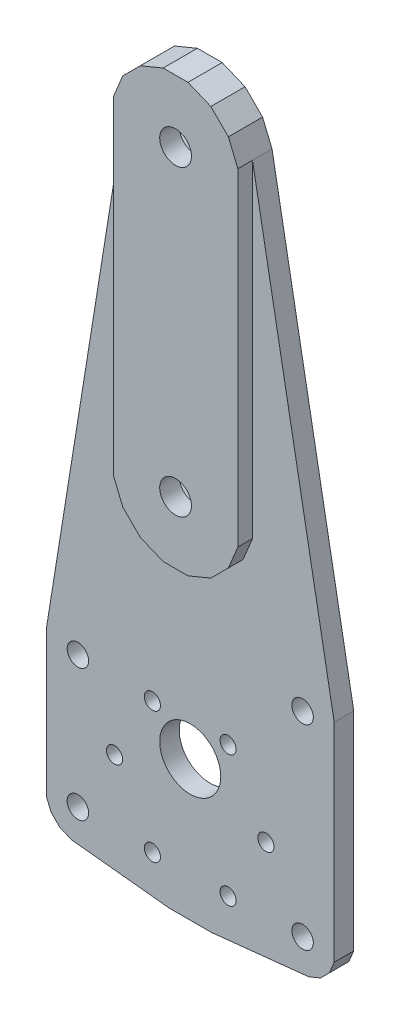
from build123d import *

# Parameters (mm, degrees)
PROFILE_1_R         = 3.25
PROFILE_1_R_2       = 6.25
PROFILE_1_R_3       = 1.65
PROFILE_1_R_4       = 2.2
WHEEL_CARRIER_DEPTH = 4
PIVOT_LANDS_START   = 4
PROFILE_2_R         = 3.25
PIVOT_LANDS_DEPTH   = 3
NUT_SEATS_C_D_START = -0.01
NUT_SEATS_C_D_DEPTH = 3.01


with BuildPart() as part:
    # Profile_1 → Wheel_carrier (new body)
    with BuildSketch(Plane.XY):
        Polygon((-12.750208645, 2.536174186), (-29.473182851, -101.712403875), (-29.473182851, -131.287596125), (-28.487699441, -133.666763538), (-26.666763538, -135.487699441), (-24.287596125, -136.473182851), (-4.291987084, -138.577276169), (4.291987084, -138.577276169), (24.287596125, -136.473182851), (26.666763538, -135.487699441), (28.487699441, -133.666763538), (29.473182851, -131.287596125), (29.473182851, -88.712403875), (12.750208645, 2.536174186), (10.80910496, 7.222413029), (7.222413029, 10.80910496), (2.536174186, 12.750208645), (-2.536174186, 12.750208645), (-7.222413029, 10.80910496), (-10.80910496, 7.222413029), align=None)
        Circle(PROFILE_1_R, mode=Mode.SUBTRACT)
        with Locations((0, -62)):
            Circle(PROFILE_1_R, mode=Mode.SUBTRACT)
        with Locations((0, -110)):
            Circle(PROFILE_1_R_2, mode=Mode.SUBTRACT)
        with Locations((15.5, -117)):
            Circle(PROFILE_1_R_3, mode=Mode.SUBTRACT)
        with Locations((7.75, -103.576606241)):
            Circle(PROFILE_1_R_3, mode=Mode.SUBTRACT)
        with Locations((-7.75, -103.576606241)):
            Circle(PROFILE_1_R_3, mode=Mode.SUBTRACT)
        with Locations((-15.5, -117)):
            Circle(PROFILE_1_R_3, mode=Mode.SUBTRACT)
        with Locations((-7.75, -130.423393759)):
            Circle(PROFILE_1_R_3, mode=Mode.SUBTRACT)
        with Locations((7.75, -130.423393759)):
            Circle(PROFILE_1_R_3, mode=Mode.SUBTRACT)
        with Locations((-23, -130)):
            Circle(PROFILE_1_R_4, mode=Mode.SUBTRACT)
        with Locations((23, -130)):
            Circle(PROFILE_1_R_4, mode=Mode.SUBTRACT)
        with Locations((-23, -103)):
            Circle(PROFILE_1_R_4, mode=Mode.SUBTRACT)
        with Locations((23, -90)):
            Circle(PROFILE_1_R_4, mode=Mode.SUBTRACT)
    extrude(amount=WHEEL_CARRIER_DEPTH)

    # Profile_2 → Pivot_lands (add)
    with BuildSketch(Plane.XY.offset(PIVOT_LANDS_START)):
        Polygon((12.750208645, -64.536174186), (12.750208645, 2.536174186), (10.80910496, 7.222413029), (7.222413029, 10.80910496), (2.536174186, 12.750208645), (-2.536174186, 12.750208645), (-7.222413029, 10.80910496), (-10.80910496, 7.222413029), (-12.750208645, 2.536174186), (-12.750208645, -64.536174186), (-10.80910496, -69.222413029), (-7.222413029, -72.80910496), (-2.536174186, -74.750208645), (2.536174186, -74.750208645), (7.222413029, -72.80910496), (10.80910496, -69.222413029), align=None)
        Circle(PROFILE_2_R, mode=Mode.SUBTRACT)
        with Locations((0, -62)):
            Circle(PROFILE_2_R, mode=Mode.SUBTRACT)
    extrude(amount=PIVOT_LANDS_DEPTH)

    # Profile_3 → Nut_seats_C_D (cut)
    with BuildSketch(Plane.XY.offset(NUT_SEATS_C_D_START)):
        Polygon((5.175, 2.987787643), (0, 5.975575286), (-5.175, 2.987787643), (-5.175, -2.987787643), (0, -5.975575286), (5.175, -2.987787643), align=None)
        Polygon((5.175, -59.012212357), (0, -56.024424714), (-5.175, -59.012212357), (-5.175, -64.987787643), (0, -67.975575286), (5.175, -64.987787643), align=None)
    extrude(amount=NUT_SEATS_C_D_DEPTH, mode=Mode.SUBTRACT)


solid = part.part
